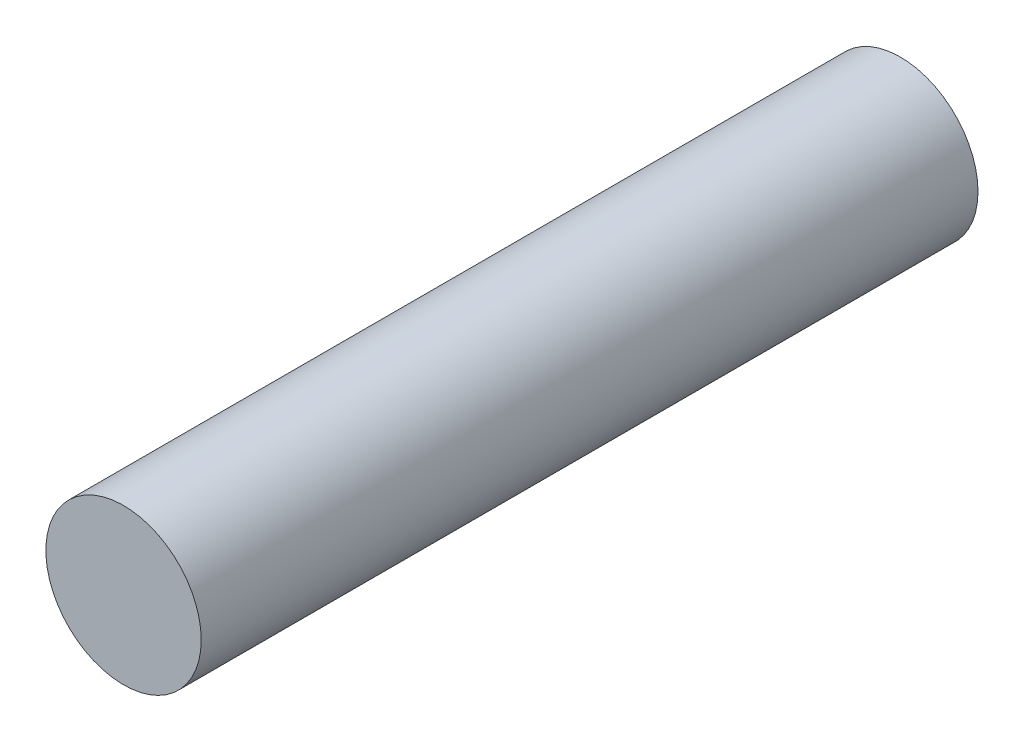
from build123d import *

# Parameters (mm, degrees)
SKETCH2_R           = 3.175
BOSS_EXTRUDE1_DEPTH = 31.75


with BuildPart() as part:
    # Sketch2 → Boss-Extrude1 (new body)
    with BuildSketch(Plane.XY):
        Circle(SKETCH2_R)
    extrude(amount=BOSS_EXTRUDE1_DEPTH)


solid = part.part
